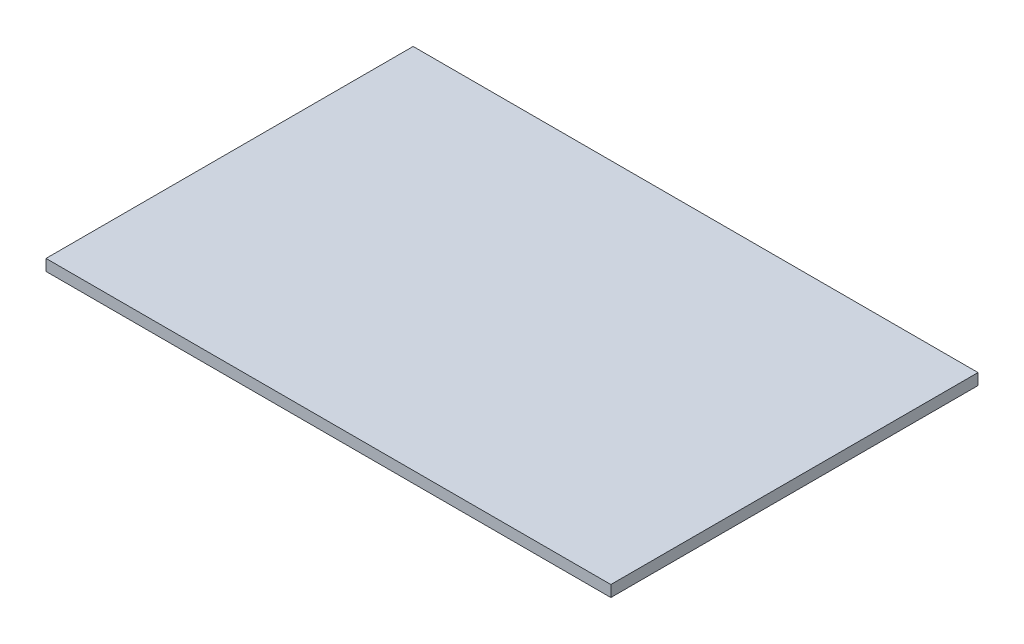
from build123d import *

# Parameters (mm, degrees)
ESBO_O1_W                = 200
ESBO_O1_H                = 130
RESSALTO_EXTRUS_O1_DEPTH = 4


with BuildPart() as part:
    # Esboço1 → Ressalto-extrusão1 (new body)
    with BuildSketch(Plane(origin=(0, 0, 0), x_dir=(1, 0, 0), z_dir=(0, 1, 0))):
        Rectangle(ESBO_O1_W, ESBO_O1_H)
    extrude(amount=RESSALTO_EXTRUS_O1_DEPTH)


solid = part.part
